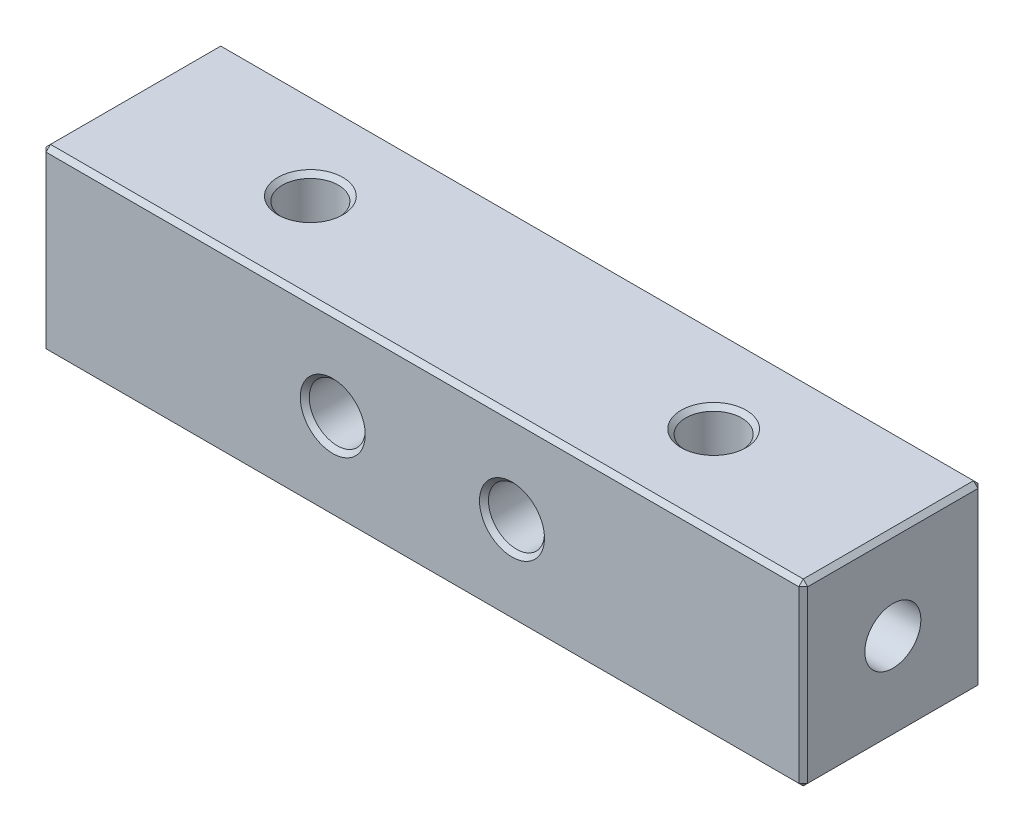
from build123d import *

# Parameters (mm, degrees)
SKETCH_1_W              = 34
SKETCH_1_H              = 8
EXTRUDE_1_DEPTH         = 4
HOLE_WIZARD_M3_1_D      = 2.5
HOLE_WIZARD_M3_2_D      = 2.5
CHAMFER_1_SIZE          = 0.2
HOLE_WIZARD_M3_3_REACH  = 36.467
HOLE_WIZARD_M3_3_BORE_R = 1.25
HOLE_WIZARD_M3_4_REACH  = 36.467
HOLE_WIZARD_M3_4_BORE_R = 1.25


with BuildPart() as part:
    # 草图1 → 凸台-拉伸1 (new, symmetric)
    with BuildSketch(Plane(origin=(0, 0, 0), x_dir=(1, 0, 0), z_dir=(0, 1, 0))):
        Rectangle(SKETCH_1_W, SKETCH_1_H)
    extrude(amount=EXTRUDE_1_DEPTH, both=True)

    # M3 螺纹孔1 (through all)
    with Locations(Plane(origin=(0, 4, 0), x_dir=(1, 0, 0), z_dir=(0, 1, 0))):
        with Locations((-9, 0), (9, 0)):
            Hole(HOLE_WIZARD_M3_1_D / 2)

    # M3 螺纹孔2 (through all)
    with Locations(Plane(origin=(0, 0, -4), x_dir=(-1, 0, 0), z_dir=(0, 0, -1))):
        with Locations((-4, 0), (4, 0)):
            Hole(HOLE_WIZARD_M3_2_D / 2)

    # 倒角1
    chamfer_1_edges = [part.edges().sort_by_distance(p)[0] for p in [
        (-17, 4, 0),
        (10.25, 4, 0),
        (10.25, -4, 0),
        (0, 4, 4),
        (-7.75, 4, 0),
        (-7.75, -4, 0),
        (-5.25, 0, -4),
        (-5.25, 0, 4),
        (2.75, 0, -4),
        (2.75, 0, 4),
        (17, 4, 0),
        (0, -4, 4),
        (-17, -4, 0),
        (0, -4, -4),
        (17, -4, 0),
        (17, 0, 4),
        (-17, 0, 4),
        (-17, 0, -4),
        (17, 0, -4),
        (0, 4, -4),
    ]]
    chamfer(chamfer_1_edges, length=CHAMFER_1_SIZE)

    # M3 螺纹孔3 bore → M3 螺纹孔3 (cut, up to next)
    with BuildSketch(Plane.ZY.offset(17), mode=Mode.PRIVATE) as hole_wizard_m3_3_sk1:
        Circle(HOLE_WIZARD_M3_3_BORE_R)
    hole_wizard_m3_3_tool1 = extrude(hole_wizard_m3_3_sk1.sketch, amount=-HOLE_WIZARD_M3_3_REACH, mode=Mode.PRIVATE) & part.part
    add(hole_wizard_m3_3_tool1.solids().sort_by_distance((-17, 0, 0))[0], mode=Mode.SUBTRACT)

    # M3 螺纹孔4 bore → M3 螺纹孔4 (cut, up to next)
    with BuildSketch(Plane(origin=(17, 0, 0), x_dir=(0, 0, -1), z_dir=(1, 0, 0)), mode=Mode.PRIVATE) as hole_wizard_m3_4_sk1:
        Circle(HOLE_WIZARD_M3_4_BORE_R)
    hole_wizard_m3_4_tool1 = extrude(hole_wizard_m3_4_sk1.sketch, amount=-HOLE_WIZARD_M3_4_REACH, mode=Mode.PRIVATE) & part.part
    add(hole_wizard_m3_4_tool1.solids().sort_by_distance((17, 0, 0))[0], mode=Mode.SUBTRACT)


solid = part.part
